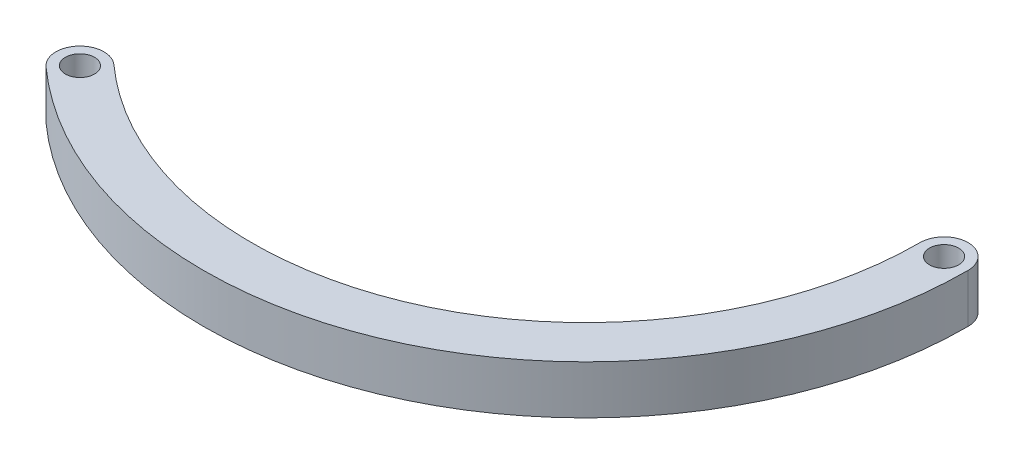
from build123d import *
from build123d.topology import SkipClean

# Parameters (mm, degrees)
SKETCH1_R           = 39.35
BOSS_EXTRUDE1_DEPTH = 5
SKETCH2_R           = 34.4
CUT_EXTRUDE1_DEPTH  = 5
CUT_EXTRUDE2_START  = -5
CUT_EXTRUDE2_DEPTH  = 5
BOSS_EXTRUDE2_START = -5
BOSS_EXTRUDE2_DEPTH = 5
BOSS_EXTRUDE3_START = -5
BOSS_EXTRUDE3_DEPTH = 5
SKETCH11_R          = 1.5
CUT_EXTRUDE3_DEPTH  = 5
SKETCH12_R          = 1.5
CUT_EXTRUDE4_DEPTH  = 5


with BuildPart() as part:
    # Sketch1 → Boss-Extrude1 (new body)
    with BuildSketch(Plane(origin=(0, 0, 0), x_dir=(1, 0, 0), z_dir=(0, 1, 0))):
        with Locations(Location((0, 0, 0), (0, 0, 270))):
            Circle(SKETCH1_R)
    extrude(amount=BOSS_EXTRUDE1_DEPTH)

    # Sketch2 → Cut-Extrude1 (cut)
    with BuildSketch(Plane(origin=(0, 5, 0), x_dir=(1, 0, 0), z_dir=(0, 1, 0))):
        with Locations(Location((0, 0, 0), (0, 0, 270))):
            Circle(SKETCH2_R)
    extrude(amount=-CUT_EXTRUDE1_DEPTH, mode=Mode.SUBTRACT)

    # Sketch4 → Cut-Extrude2 (cut)
    with SkipClean():  # the faces are left unmerged after this step: merging them gives an invalid solid
        with BuildSketch(Plane(origin=(0, 5, 0), x_dir=(1, 0, 0), z_dir=(0, 1, 0)).offset(CUT_EXTRUDE2_START)):
            with BuildLine():
                Line((-159.77746759, -178.119268716), (-26.275583759, -29.291913528))
                Line((-26.275583759, -29.291913528), (0, 0))
                Line((0, 0), (39.349993818, 0.02205808))
                ThreePointArc((39.349993818, 0.02205808), (16.048747068, -35.928543215), (-26.275583759, -29.291913528))
                ThreePointArc((-26.275583759, -29.291913528), (16.038676365, -35.933039956), (39.35, 0))
                Line((39.35, 0), (39.35, 199.930824633))
                Line((39.35, 199.930824633), (-314.435547484, 386.277611421))
                Line((-314.435547484, 386.277611421), (-513.563015073, 8.227518071))
                Line((-513.563015073, 8.227518071), (-159.77746759, -178.119268716))
            make_face()
        extrude(amount=CUT_EXTRUDE2_DEPTH, mode=Mode.SUBTRACT)

    # Sketch9 → Boss-Extrude2 (add)
    with SkipClean():  # the faces are left unmerged after this step: merging them gives an invalid solid
        with BuildSketch(Plane(origin=(0, 5, 0), x_dir=(1, 0, 0), z_dir=(0, 1, 0)).offset(BOSS_EXTRUDE2_START)):
            with BuildLine():
                Line((-22.970268903, -25.607162016), (-26.275583759, -29.291913528))
                ThreePointArc((-26.275583759, -29.291913528), (16.048747068, -35.928543215), (39.349993818, 0.02205808))
                ThreePointArc((39.349993818, 0.02205808), (36.873606818, 2.495670303), (34.399994595, 0.019283303))
                ThreePointArc((34.399994595, 0.019283303), (14.029908491, -31.40894248), (-22.970268903, -25.607162016))
            make_face()
        extrude(amount=BOSS_EXTRUDE2_DEPTH)

    # Sketch10 → Boss-Extrude3 (add)
    with SkipClean():  # the faces are left unmerged after this step: merging them gives an invalid solid
        with BuildSketch(Plane(origin=(0, 5, 0), x_dir=(1, 0, 0), z_dir=(0, 1, 0)).offset(BOSS_EXTRUDE3_START)):
            with BuildLine():
                ThreePointArc((-26.275583759, -29.291913528), (-26.465302087, -25.796880344), (-22.970268903, -25.607162016))
                ThreePointArc((-22.970268903, -25.607162016), (14.029908491, -31.40894248), (34.399994595, 0.019283303))
                ThreePointArc((34.399994595, 0.019283303), (36.873606818, 2.495670303), (39.349993818, 0.02205808))
                ThreePointArc((39.349993818, 0.02205808), (16.048747068, -35.928543215), (-26.275583759, -29.291913528))
            make_face()
        extrude(amount=BOSS_EXTRUDE3_DEPTH)

    # Sketch11 → Cut-Extrude3 (cut)
    with SkipClean():  # the faces are left unmerged after this step: merging them gives an invalid solid
        with BuildSketch(Plane(origin=(0, 5, 0), x_dir=(1, 0, 0), z_dir=(0, 1, 0))):
            with Locations(Location((-24.622926331, -27.449537772, 0), (0, 0, 270))):
                Circle(SKETCH11_R)
        extrude(amount=-CUT_EXTRUDE3_DEPTH, mode=Mode.SUBTRACT)

    # Sketch12 → Cut-Extrude4 (cut)
    with SkipClean():  # the faces are left unmerged after this step: merging them gives an invalid solid
        with BuildSketch(Plane(origin=(0, 5, 0), x_dir=(1, 0, 0), z_dir=(0, 1, 0))):
            with Locations(Location((36.874994206, 0.020670692, 0), (0, 0, 270))):
                Circle(SKETCH12_R)
        extrude(amount=-CUT_EXTRUDE4_DEPTH, mode=Mode.SUBTRACT)


solid = part.part
